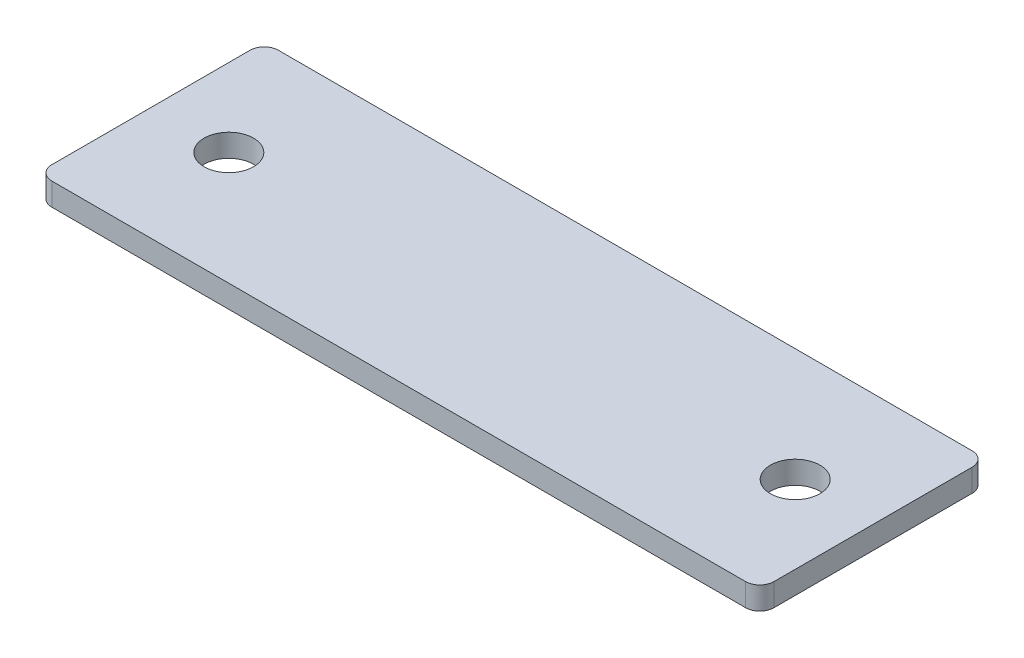
from build123d import *

# Parameters (mm, degrees)
SKETCH1_W           = 51
SKETCH1_H           = 16
SKETCH1_R           = 1.75
BOSS_EXTRUDE1_DEPTH = 1.6
FILLET1_R           = 1


with BuildPart() as part:
    # Sketch1 → Boss-Extrude1 (new body)
    with BuildSketch(Plane(origin=(0, 0, 0), x_dir=(1, 0, 0), z_dir=(0, 1, 0))):
        Rectangle(SKETCH1_W, SKETCH1_H)
        with Locations(Location((-20, 0, 0), (0, 0, 270))):
            Circle(SKETCH1_R, mode=Mode.SUBTRACT)
        with Locations(Location((20, 0, 0), (0, 0, 270))):
            Circle(SKETCH1_R, mode=Mode.SUBTRACT)
    extrude(amount=BOSS_EXTRUDE1_DEPTH)

    # Fillet1
    fillet1_edges = [part.edges().sort_by_distance(p)[0] for p in [
        (25.5, 0.8, 8),
        (-25.5, 0.8, 8),
        (-25.5, 0.8, -8),
        (25.5, 0.8, -8),
    ]]
    fillet(fillet1_edges, radius=FILLET1_R)


solid = part.part
